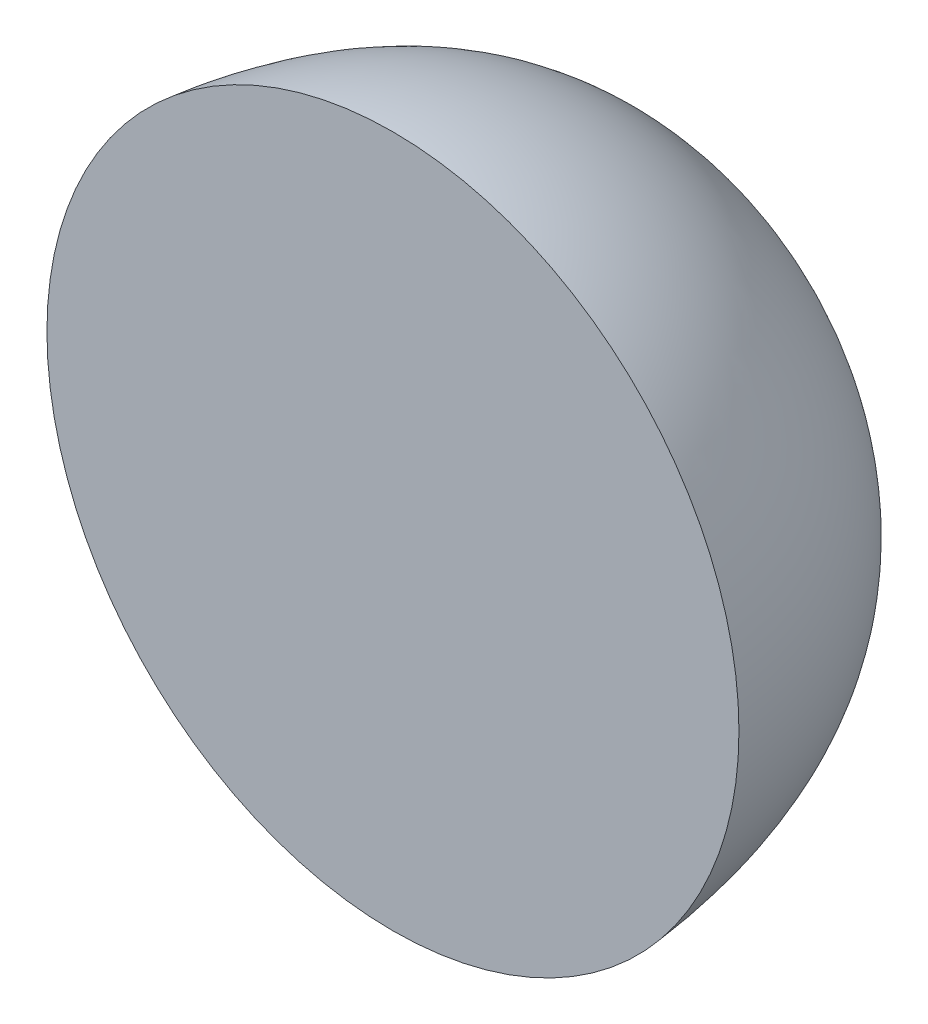
from build123d import *


with BuildPart() as part:
    # Sketch3 → Revolve1 (revolve)
    with BuildSketch(Plane(origin=(0, 0, 0), x_dir=(1, 0, 0), z_dir=(0, 1, 0))):
        with BuildLine():
            Line((0, 0), (0, 20))
            add(Edge.make_bspline(
                [(0, 20), (19.359501992, 20.534724569), (21.5, 0)],
                knots=[0, 0, 0, 1, 1, 1], degree=2))
            Line((21.5, 0), (0, 0))
        make_face()
    revolve(axis=Axis((0, 0, 0), (0, 0, -1)))


solid = part.part
